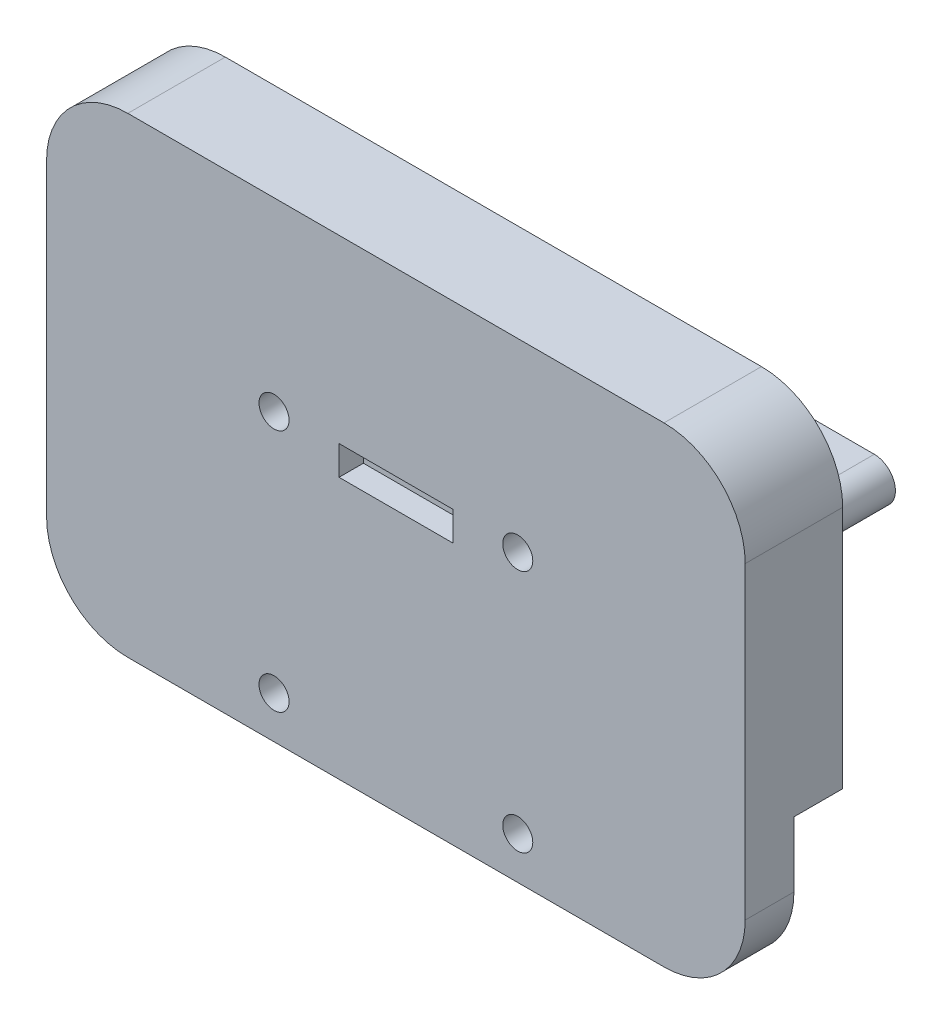
from build123d import *

# Parameters (mm, degrees)
SKETCH_1_W           = 27
SKETCH_1_H           = 20
EXTRUDE_1_DEPTH      = 4
SKETCH_2_W           = 6.8
SKETCH_2_H           = 1.6
CUT_EXTRUDE_1_DEPTH  = 1.5
EXTRUDE_2_DEPTH      = 3
SKETCH_5_W           = 27
SKETCH_5_H           = 4
EXTRUDE_3_DEPTH      = 4
SKETCH_9_W           = 27
SKETCH_9_H           = 20
CUT_EXTRUDE_4_DEPTH  = 2
EXTRUDE_6_DEPTH      = 8
EXTRUDE_7_DEPTH      = 8
SKETCH_12_W          = 43
SKETCH_12_H          = 16
EXTRUDE_8_DEPTH      = 20
SKETCH_13_W          = 43
SKETCH_13_H          = 16
CUT_EXTRUDE_5_DEPTH  = 20
CUT_EXTRUDE_6_DEPTH  = 16
SKETCH_17_W          = 7
SKETCH_17_H          = 1.8
CUT_EXTRUDE_8_DEPTH  = 1.5
SKETCH_18_W          = 43
SKETCH_18_H          = 4
EXTRUDE_9_DEPTH      = 5
SKETCH_19_R          = 0.925
CUT_EXTRUDE_9_DEPTH  = 5
SKETCH_20_W          = 7
SKETCH_20_H          = 1.8
CUT_EXTRUDE_10_DEPTH = 1.5
SKETCH_21_W          = 7
SKETCH_21_H          = 1.8
EXTRUDE_10_DEPTH     = 1.5
FILLET_2_R           = 5
EXTRUDE_11_DEPTH     = 4
EXTRUDE_12_DEPTH     = 4
CUT_EXTRUDE_11_DEPTH = 1
SKETCH_25_R          = 0.925
EXTRUDE_13_DEPTH     = 1
EXTRUDE_START        = 1
EXTRUDE_14_DEPTH     = 1


with BuildPart() as part:
    # 草图1 → 凸台-拉伸1 (new body)
    with BuildSketch(Plane.XY):
        Rectangle(SKETCH_1_W, SKETCH_1_H)
    extrude(amount=EXTRUDE_1_DEPTH)

    # 草图2 → 切除-拉伸1 (cut)
    with BuildSketch(Plane(origin=(6.414908285, -0.597250082, 4), x_dir=(1, 0, 0), z_dir=(0, 0, 1))):
        with Locations((-6.414908285, 7.597250082)):
            Rectangle(SKETCH_2_W, SKETCH_2_H)
    extrude(amount=-CUT_EXTRUDE_1_DEPTH, mode=Mode.SUBTRACT)

    # 草图4 → 凸台-拉伸2 (add)
    with BuildSketch(Plane(origin=(0, 0, 0), x_dir=(-1, 0, 0), z_dir=(0, 0, -1))):
        Polygon((-13.5, 10), (-13.5, 14), (13.5, 14), (13.5, 10), (13.5, -6), (-13.5, -6), align=None)
    extrude(amount=EXTRUDE_2_DEPTH)

    # 草图5 → 凸台-拉伸3 (add)
    with BuildSketch(Plane(origin=(0, 10, 0), x_dir=(1, 0, 0), z_dir=(0, 1, 0))):
        with Locations((0, -2)):
            Rectangle(SKETCH_5_W, SKETCH_5_H)
    extrude(amount=EXTRUDE_3_DEPTH)

    # 草图9 → 切除-拉伸4 (cut)
    with BuildSketch(Plane(origin=(0, 0, -3), x_dir=(-1, 0, 0), z_dir=(0, 0, -1))):
        with Locations((0, 4)):
            Rectangle(SKETCH_9_W, SKETCH_9_H)
    extrude(amount=-CUT_EXTRUDE_4_DEPTH, mode=Mode.SUBTRACT)

    # 草图10 → 凸台-拉伸6 (add)
    with BuildSketch(Plane.ZY.offset(13.5)):
        Polygon((-1, 14), (-1, -6), (0, -6), (0, -10), (4, -10), (4, 14), align=None)
    extrude(amount=EXTRUDE_6_DEPTH)

    # 草图11 → 凸台-拉伸7 (add)
    with BuildSketch(Plane(origin=(13.5, 0, 0), x_dir=(0, 0, -1), z_dir=(1, 0, 0))):
        Polygon((1, -6), (1, 14), (-4, 14), (-4, -10), (0, -10), (0, -6), align=None)
    extrude(amount=EXTRUDE_7_DEPTH)

    # 草图12 → 凸台-拉伸8 (add)
    with BuildSketch(Plane(origin=(0, 0, -1), x_dir=(-1, 0, 0), z_dir=(0, 0, -1))):
        with Locations((0, 6)):
            Rectangle(SKETCH_12_W, SKETCH_12_H)
    extrude(amount=EXTRUDE_8_DEPTH)

    # 草图13 → 切除-拉伸5 (cut)
    with BuildSketch(Plane(origin=(6.414908285, -0.597250082, -21), x_dir=(-1, 0, 0), z_dir=(0, 0, -1))):
        with Locations((6.414908285, 6.597250082)):
            Rectangle(SKETCH_13_W, SKETCH_13_H)
        with BuildLine():
            Line((26.283170409, 7.191066942), (21.049236483, 4.748564443))
            ThreePointArc((21.049236483, 4.748564443), (19.609145385, 4.842633182), (18.914908285, 6.107839153))
            Line((18.914908285, 6.107839153), (18.914908285, 8.097250082))
            ThreePointArc((18.914908285, 8.097250082), (19.207801504, 8.804356863), (19.914908285, 9.097250082))
            Line((19.914908285, 9.097250082), (25.860284943, 9.097250082))
            ThreePointArc((25.860284943, 9.097250082), (26.836549031, 8.313833622), (26.283170409, 7.191066942))
        make_face(mode=Mode.SUBTRACT)
        with BuildLine():
            Line((-13.453353838, 7.191066942), (-8.219419913, 4.748564443))
            ThreePointArc((-8.219419913, 4.748564443), (-6.779328815, 4.842633182), (-6.085091715, 6.107839153))
            Line((-6.085091715, 6.107839153), (-6.085091715, 8.097250082))
            ThreePointArc((-6.085091715, 8.097250082), (-6.377984934, 8.804356863), (-7.085091715, 9.097250082))
            Line((-7.085091715, 9.097250082), (-13.030468373, 9.097250082))
            ThreePointArc((-13.030468373, 9.097250082), (-14.006732461, 8.313833622), (-13.453353838, 7.191066942))
        make_face(mode=Mode.SUBTRACT)
    extrude(amount=-CUT_EXTRUDE_5_DEPTH, mode=Mode.SUBTRACT)

    # 草图14 → 切除-拉伸6 (cut)
    with BuildSketch(Plane(origin=(6.414908285, -0.597250082, -21), x_dir=(-1, 0, 0), z_dir=(0, 0, -1))):
        with BuildLine():
            Line((21.049236483, 4.748564443), (26.283170409, 7.191066942))
            ThreePointArc((26.283170409, 7.191066942), (26.836549031, 8.313833622), (25.860284943, 9.097250082))
            Line((25.860284943, 9.097250082), (19.914908285, 9.097250082))
            ThreePointArc((19.914908285, 9.097250082), (19.207801504, 8.804356863), (18.914908285, 8.097250082))
            Line((18.914908285, 8.097250082), (18.914908285, 6.107839153))
            ThreePointArc((18.914908285, 6.107839153), (19.609145385, 4.842633182), (21.049236483, 4.748564443))
        make_face()
        with BuildLine():
            Line((-7.085091715, 9.097250082), (-13.030468373, 9.097250082))
            ThreePointArc((-13.030468373, 9.097250082), (-14.006732461, 8.313833622), (-13.453353838, 7.191066942))
            Line((-13.453353838, 7.191066942), (-8.219419913, 4.748564443))
            ThreePointArc((-8.219419913, 4.748564443), (-6.779328815, 4.842633182), (-6.085091715, 6.107839153))
            Line((-6.085091715, 6.107839153), (-6.085091715, 8.097250082))
            ThreePointArc((-6.085091715, 8.097250082), (-6.377984934, 8.804356863), (-7.085091715, 9.097250082))
        make_face()
    extrude(amount=-CUT_EXTRUDE_6_DEPTH, mode=Mode.SUBTRACT)

    # 草图17 → 切除-拉伸8 (cut)
    with BuildSketch(Plane.XY.offset(4)):
        with Locations((0, 7)):
            Rectangle(SKETCH_17_W, SKETCH_17_H)
    extrude(amount=-CUT_EXTRUDE_8_DEPTH, mode=Mode.SUBTRACT)

    # 草图18 → 凸台-拉伸9 (add)
    with BuildSketch(Plane.XZ.offset(10)):
        with Locations((0, 2)):
            Rectangle(SKETCH_18_W, SKETCH_18_H)
    extrude(amount=EXTRUDE_9_DEPTH)

    # 草图19 → 切除-拉伸9 (cut)
    with BuildSketch(Plane.XY.offset(4)):
        with Locations((-7.5, 2.6)):
            Circle(SKETCH_19_R)
        with Locations((7.5, 2.6)):
            Circle(SKETCH_19_R)
        with Locations((7.5, -12.4)):
            Circle(SKETCH_19_R)
        with Locations((-7.5, -12.4)):
            Circle(SKETCH_19_R)
    extrude(amount=-CUT_EXTRUDE_9_DEPTH, mode=Mode.SUBTRACT)

    # 草图20 → 切除-拉伸10 (cut)
    with BuildSketch(Plane.XY.offset(4)):
        with Locations((0, 2)):
            Rectangle(SKETCH_20_W, SKETCH_20_H)
    extrude(amount=-CUT_EXTRUDE_10_DEPTH, mode=Mode.SUBTRACT)

    # 草图21 → 凸台-拉伸10 (add)
    with BuildSketch(Plane.XY.offset(4)):
        with Locations((0, 7)):
            Rectangle(SKETCH_21_W, SKETCH_21_H)
    extrude(amount=-EXTRUDE_10_DEPTH)

    # 圆角2
    fillet_2_edges = [part.edges().sort_by_distance(p)[0] for p in [
        (21.5, 14, 1.5),
        (-21.5, -15, 2),
        (21.5, -15, 2),
        (-21.5, 14, 1.5),
    ]]
    fillet(fillet_2_edges, radius=FILLET_2_R)

    # 草图22 → 凸台-拉伸11 (add)
    # profile 1 of 2: a face of its own
    with BuildSketch(Plane(origin=(0, 0, -5), x_dir=(-1, 0, 0), z_dir=(0, 0, -1))):
        with BuildLine():
            Line((-13.5, 8.6), (-19.445376658, 8.6))
            ThreePointArc((-19.445376658, 8.6), (-20.519267155, 7.738241895), (-19.91055067, 6.503198546))
            Line((-19.91055067, 6.503198546), (-14.676616745, 4.060696047))
            ThreePointArc((-14.676616745, 4.060696047), (-13.140519573, 4.161036036), (-12.4, 5.510589071))
            Line((-12.4, 5.510589071), (-12.4, 7.5))
            ThreePointArc((-12.4, 7.5), (-12.722182541, 8.277817459), (-13.5, 8.6))
        make_face()
        with BuildLine():
            Line((-13.5, 8.5), (-19.445376658, 8.5))
            ThreePointArc((-19.445376658, 8.5), (-20.421640746, 7.71658354), (-19.868262123, 6.59381686))
            Line((-19.868262123, 6.59381686), (-14.634328198, 4.151314361))
            ThreePointArc((-14.634328198, 4.151314361), (-13.1942371, 4.245383101), (-12.5, 5.510589071))
            Line((-12.5, 5.510589071), (-12.5, 7.5))
            ThreePointArc((-12.5, 7.5), (-12.792893219, 8.207106781), (-13.5, 8.5))
        make_face(mode=Mode.SUBTRACT)
    # profile 2 of 2: a face of its own
    with BuildSketch(Plane(origin=(0, 0, -5), x_dir=(-1, 0, 0), z_dir=(0, 0, -1))):
        with BuildLine():
            Line((19.445376658, 8.6), (13.5, 8.6))
            ThreePointArc((13.5, 8.6), (12.722182541, 8.277817459), (12.4, 7.5))
            Line((12.4, 7.5), (12.4, 5.510589071))
            ThreePointArc((12.4, 5.510589071), (13.140519573, 4.161036036), (14.676616745, 4.060696047))
            Line((14.676616745, 4.060696047), (19.91055067, 6.503198546))
            ThreePointArc((19.91055067, 6.503198546), (20.519267155, 7.738241895), (19.445376658, 8.6))
        make_face()
        with BuildLine():
            Line((14.634328198, 4.151314361), (19.868262123, 6.59381686))
            ThreePointArc((19.868262123, 6.59381686), (20.421640746, 7.71658354), (19.445376658, 8.5))
            Line((19.445376658, 8.5), (13.5, 8.5))
            ThreePointArc((13.5, 8.5), (12.792893219, 8.207106781), (12.5, 7.5))
            Line((12.5, 7.5), (12.5, 5.510589071))
            ThreePointArc((12.5, 5.510589071), (13.1942371, 4.245383101), (14.634328198, 4.151314361))
        make_face(mode=Mode.SUBTRACT)
    extrude(amount=-EXTRUDE_11_DEPTH)

    # 草图23 → 凸台-拉伸12 (add)
    # profile 1 of 2: a face of its own
    with BuildSketch(Plane(origin=(0, 0, -5), x_dir=(-1, 0, 0), z_dir=(0, 0, -1))):
        with BuildLine():
            Line((-13.5, 8.8), (-19.445376658, 8.8))
            ThreePointArc((-19.445376658, 8.8), (-20.714519973, 7.781558603), (-19.995127763, 6.321961918))
            Line((-19.995127763, 6.321961918), (-14.761193838, 3.879459419))
            ThreePointArc((-14.761193838, 3.879459419), (-13.03308452, 3.992341907), (-12.2, 5.510589071))
            Line((-12.2, 5.510589071), (-12.2, 7.5))
            ThreePointArc((-12.2, 7.5), (-12.580761184, 8.419238816), (-13.5, 8.8))
        make_face()
        with BuildLine():
            Line((-13.5, 8.6), (-19.445376658, 8.6))
            ThreePointArc((-19.445376658, 8.6), (-20.519267155, 7.738241895), (-19.91055067, 6.503198546))
            Line((-19.91055067, 6.503198546), (-14.676616745, 4.060696047))
            ThreePointArc((-14.676616745, 4.060696047), (-13.140519573, 4.161036036), (-12.4, 5.510589071))
            Line((-12.4, 5.510589071), (-12.4, 7.5))
            ThreePointArc((-12.4, 7.5), (-12.722182541, 8.277817459), (-13.5, 8.6))
        make_face(mode=Mode.SUBTRACT)
    # profile 2 of 2: a face of its own
    with BuildSketch(Plane(origin=(0, 0, -5), x_dir=(-1, 0, 0), z_dir=(0, 0, -1))):
        with BuildLine():
            Line((19.445376658, 8.8), (13.5, 8.8))
            ThreePointArc((13.5, 8.8), (12.580761184, 8.419238816), (12.2, 7.5))
            Line((12.2, 7.5), (12.2, 5.510589071))
            ThreePointArc((12.2, 5.510589071), (13.03308452, 3.992341907), (14.761193838, 3.879459419))
            Line((14.761193838, 3.879459419), (19.995127763, 6.321961918))
            ThreePointArc((19.995127763, 6.321961918), (20.714519973, 7.781558603), (19.445376658, 8.8))
        make_face()
        with BuildLine():
            Line((19.445376658, 8.6), (13.5, 8.6))
            ThreePointArc((13.5, 8.6), (12.722182541, 8.277817459), (12.4, 7.5))
            Line((12.4, 7.5), (12.4, 5.510589071))
            ThreePointArc((12.4, 5.510589071), (13.140519573, 4.161036036), (14.676616745, 4.060696047))
            Line((14.676616745, 4.060696047), (19.91055067, 6.503198546))
            ThreePointArc((19.91055067, 6.503198546), (20.519267155, 7.738241895), (19.445376658, 8.6))
        make_face(mode=Mode.SUBTRACT)
    extrude(amount=-EXTRUDE_12_DEPTH)

    # 草图24 → 切除-拉伸11 (cut)
    with BuildSketch(Plane(origin=(0, 0, 0), x_dir=(-1, 0, 0), z_dir=(0, 0, -1))):
        with BuildLine():
            Line((-21.5, -6), (-21.5, -10))
            ThreePointArc((-21.5, -10), (-20.035533906, -13.535533906), (-16.5, -15))
            Line((-16.5, -15), (16.5, -15))
            ThreePointArc((16.5, -15), (20.035533906, -13.535533906), (21.5, -10))
            Line((21.5, -10), (21.5, -6))
            Line((21.5, -6), (-21.5, -6))
        make_face()
    extrude(amount=-CUT_EXTRUDE_11_DEPTH, mode=Mode.SUBTRACT)

    # 草图25 → 凸台-拉伸13 (add)
    with BuildSketch(Plane(origin=(0, 0, -1), x_dir=(-1, 0, 0), z_dir=(0, 0, -1))):
        with BuildLine():
            Line((16.5, 14), (-16.5, 14))
            ThreePointArc((-16.5, 14), (-20.035533906, 12.535533906), (-21.5, 9))
            Line((-21.5, 9), (-21.5, -6))
            Line((-21.5, -6), (21.5, -6))
            Line((21.5, -6), (21.5, 9))
            ThreePointArc((21.5, 9), (20.035533906, 12.535533906), (16.5, 14))
        make_face()
        with Locations(Location((-7.5, 2.6, 0), (0, 0, 180))):
            Circle(SKETCH_25_R, mode=Mode.SUBTRACT)
        with Locations(Location((7.5, 2.6, 0), (0, 0, 180))):
            Circle(SKETCH_25_R, mode=Mode.SUBTRACT)
    extrude(amount=EXTRUDE_13_DEPTH)

    # 草图26 → 凸台-拉伸14 (add)
    with BuildSketch(Plane(origin=(0, 0, -5), x_dir=(-1, 0, 0), z_dir=(0, 0, -1)).offset(EXTRUDE_START)):
        with BuildLine():
            Line((-13.5, 8.8), (-19.445376658, 8.8))
            ThreePointArc((-19.445376658, 8.8), (-20.714519973, 7.781558603), (-19.995127763, 6.321961918))
            Line((-19.995127763, 6.321961918), (-14.761193838, 3.879459419))
            ThreePointArc((-14.761193838, 3.879459419), (-13.03308452, 3.992341907), (-12.2, 5.510589071))
            Line((-12.2, 5.510589071), (-12.2, 7.5))
            ThreePointArc((-12.2, 7.5), (-12.580761184, 8.419238816), (-13.5, 8.8))
        make_face()
        with BuildLine():
            Line((19.445376658, 8.8), (13.5, 8.8))
            ThreePointArc((13.5, 8.8), (12.580761184, 8.419238816), (12.2, 7.5))
            Line((12.2, 7.5), (12.2, 5.510589071))
            ThreePointArc((12.2, 5.510589071), (13.03308452, 3.992341907), (14.761193838, 3.879459419))
            Line((14.761193838, 3.879459419), (19.995127763, 6.321961918))
            ThreePointArc((19.995127763, 6.321961918), (20.714519973, 7.781558603), (19.445376658, 8.8))
        make_face()
    extrude(amount=-EXTRUDE_14_DEPTH)


solid = part.part
